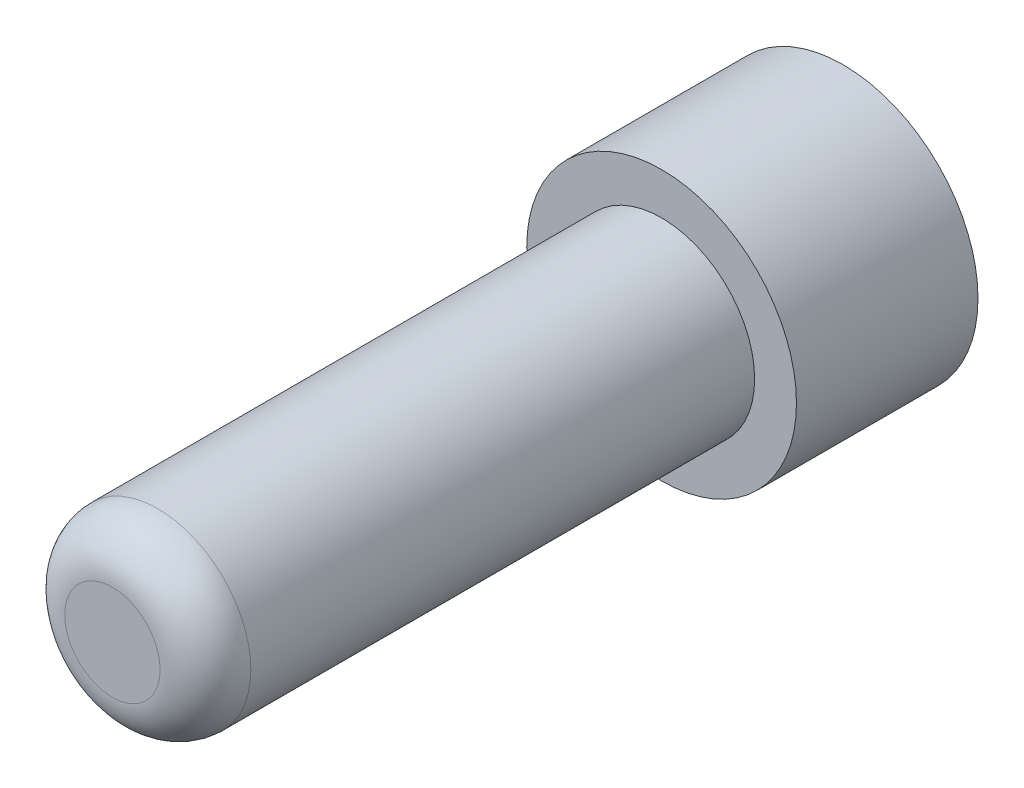
from build123d import *

# Parameters (mm, degrees)
FILLET1_R = 2.54


with BuildPart() as part:
    # Sketch1 → Revolve1 (revolve)
    with BuildSketch(Plane(origin=(0, 0, 0), x_dir=(0, 0, -1), z_dir=(1, 0, 0)), mode=Mode.PRIVATE) as revolve1_sk:
        Polygon((20.447, 0), (20.447, 7.547224719), (10.287, 7.547224719), (10.287, 5.207), (-20.447, 5.207), (-20.447, 0), align=None)
    revolve(revolve1_sk.sketch.rotate(Axis((0, 0, 26.99059176), (0, 0, -1)), 90), axis=Axis((0, 0, 26.99059176), (0, 0, -1)))

    # Fillet1
    fillet1_edges = [part.edges().sort_by_distance(p)[0] for p in [
        (-5.207, 0, 20.447),
    ]]
    fillet(fillet1_edges, radius=FILLET1_R)


solid = part.part
